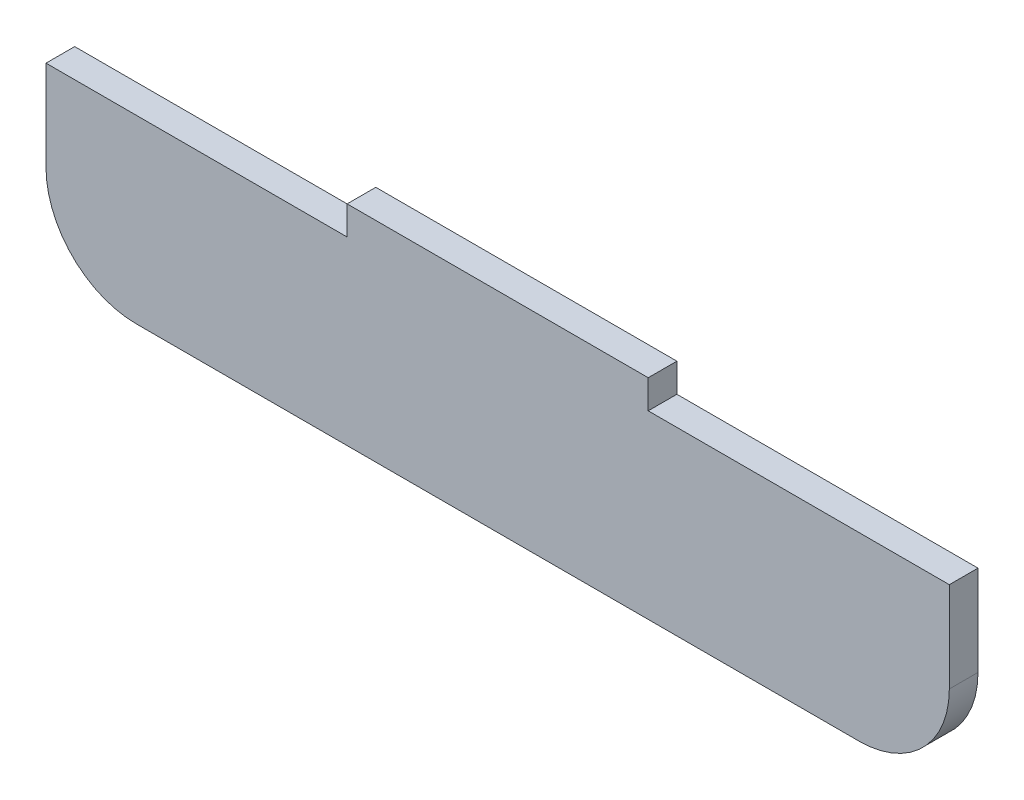
from build123d import *

# Parameters (mm, degrees)
BOSS_EXTRUDE1_DEPTH = 3.175
FILLET1_R           = 10


with BuildPart() as part:
    # Sketch1 → Boss-Extrude1 (new body)
    with BuildSketch(Plane.XY):
        Polygon((0, 20), (33.333333333, 20), (33.333333333, 23.175), (66.666666667, 23.175), (66.666666667, 20), (100, 20), (100, 0), (0, 0), align=None)
    extrude(amount=BOSS_EXTRUDE1_DEPTH)

    # Fillet1
    fillet1_edges = [part.edges().sort_by_distance(p)[0] for p in [
        (100, 0, 1.5875),
        (0, 0, 1.5875),
    ]]
    fillet(fillet1_edges, radius=FILLET1_R)


solid = part.part
